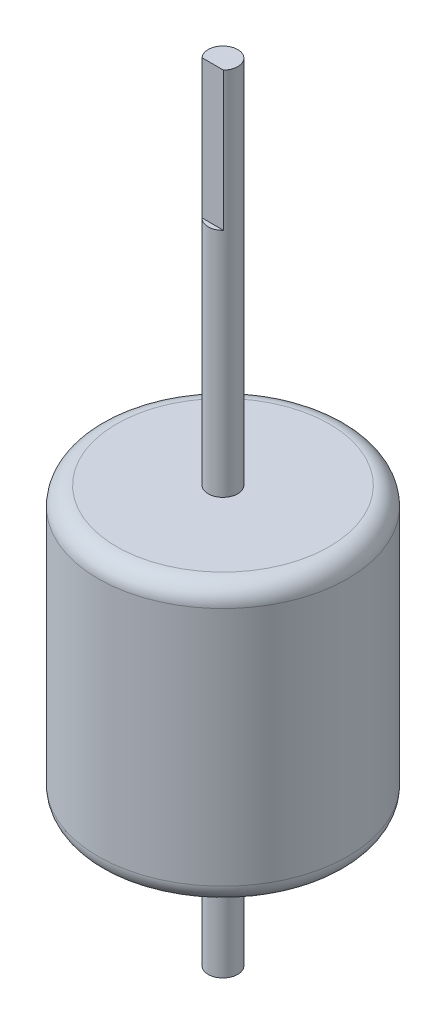
from build123d import *

# Parameters (mm, degrees)
ENL_V_MAT_EXTRU_1_DEPTH                   = 15
TROU_TARAUD_M31_D                         = 2.5
TROU_TARAUD_M31_DEPTH                     = 8.5
TROU_TARAUD_M31_TIP                       = 0.751075774
ESQUISSE5_W                               = 0.7
ESQUISSE5_H                               = 3.8
BOSS_EXTRU_1_DEPTH                        = 6.7
CHANFREIN1_SIZE                           = 1
ESQUISSE6_R                               = 0.8
ENL_V_MAT_EXTRU_2_DEPTH                   = 6.7
R_P_TITION_CIRCULAIRE1_COUNT              = 2
CHANFREIN1_OF_R_P_TITION_CIRCULAIRE1_SIZE = 1
ENL_V_MAT_EXTRU_4_DEPTH                   = 90.145947749
ENL_V_MAT_EXTRU_4_DEPTH_BACK              = 90.145947749
ESQUISSE7_R                               = 19
ESQUISSE7_R_2                             = 1.6


with BuildPart() as part:
    # Esquisse1 → Révolution1 (revolve)
    with BuildSketch(Plane.XY, mode=Mode.PRIVATE) as r_volution1_sk:
        with BuildLine():
            Line((0, 0), (-1.6, 0))
            Line((-1.6, 0), (-1.6, 2.6))
            Line((-1.6, 2.6), (-5.075, 2.6))
            Line((-5.075, 2.6), (-5.075, 4.5))
            Line((-5.075, 4.5), (-19, 4.5))
            Line((-19, 4.5), (-19, 58))
            Line((-19, 58), (-17.85, 58))
            Line((-17.85, 58), (-17.85, 60))
            ThreePointArc((-17.85, 60), (-17.410660172, 61.060660172), (-16.35, 61.5))
            Line((-16.35, 61.5), (-6.5, 61.5))
            Line((-6.5, 61.5), (-6.5, 65.8))
            Line((-6.5, 65.8), (-1.6, 65.8))
            Line((-1.6, 65.8), (-1.6, 85))
            Line((-1.6, 85), (0, 85))
            Line((0, 85), (0, 0))
        make_face()
    revolve(r_volution1_sk.sketch.rotate(Axis((0, 0, 0), (0, 1, 0)), 270), axis=Axis((0, 0, 0), (0, 1, 0)))

    # Esquisse2 → Enlèv. mat.-Extru.1 (cut)
    with BuildSketch(Plane(origin=(0, 85, 0), x_dir=(1, 0, 0), z_dir=(0, 1, 0))):
        with BuildLine():
            Line((-1.161895004, -1.1), (1.161895004, -1.1))
            ThreePointArc((1.161895004, -1.1), (0, -1.6), (-1.161895004, -1.1))
        make_face()
    extrude(amount=-ENL_V_MAT_EXTRU_1_DEPTH, mode=Mode.SUBTRACT)

    # Trou taraudé M31
    with Locations(Plane(origin=(0, 61.5, 0), x_dir=(-1, 0, 0), z_dir=(0, 1, 0))):
        with Locations((12.5, 0), (-12.5, 0)):
            Hole(TROU_TARAUD_M31_D / 2, depth=TROU_TARAUD_M31_DEPTH)
            with Locations((0, 0, -(TROU_TARAUD_M31_DEPTH + TROU_TARAUD_M31_TIP / 2))):  # 118° drill point
                Cone(0, TROU_TARAUD_M31_D / 2, TROU_TARAUD_M31_TIP, mode=Mode.SUBTRACT)

    # Esquisse5 → Boss.-Extru.1 (add)
    with BuildSketch(Plane.XZ.offset(-4.5)):
        with Locations((-13.95, 0)):
            Rectangle(ESQUISSE5_W, ESQUISSE5_H)
    boss_extru_1 = extrude(amount=BOSS_EXTRU_1_DEPTH)

    # Chanfrein1
    chanfrein1_edges = [part.edges().sort_by_distance(p)[0] for p in [
        (-13.95, -2.2, -1.9),
        (-13.95, -2.2, 1.9),
    ]]
    chamfer(chanfrein1_edges, length=CHANFREIN1_SIZE)

    # Esquisse6 → Enlèv. mat.-Extru.2 (cut)
    with BuildSketch(Plane.ZY.offset(14.3)):
        Circle(ESQUISSE6_R)
    enl_v_mat_extru_2 = extrude(amount=-ENL_V_MAT_EXTRU_2_DEPTH, mode=Mode.SUBTRACT)

    # Répétition circulaire1: Boss.-Extru.1, Enlèv. mat.-Extru.2 ×2 about axis
    r_p_tition_circulaire1_axis = Axis((0, 0, 0), (0, 1, 0))
    add([boss_extru_1.rotate(r_p_tition_circulaire1_axis, i * 360 / R_P_TITION_CIRCULAIRE1_COUNT) for i in range(1, R_P_TITION_CIRCULAIRE1_COUNT)])
    add([enl_v_mat_extru_2.rotate(r_p_tition_circulaire1_axis, i * 360 / R_P_TITION_CIRCULAIRE1_COUNT) for i in range(1, R_P_TITION_CIRCULAIRE1_COUNT)], mode=Mode.SUBTRACT)

    # Chanfrein1 of Répétition circulaire1
    chanfrein1_of_r_p_tition_circulaire1_edges = [part.edges().sort_by_distance(p)[0] for p in [
        (13.95, -2.2, 1.9),
        (13.95, -2.2, -1.9),
    ]]
    chamfer(chanfrein1_of_r_p_tition_circulaire1_edges, length=CHANFREIN1_OF_R_P_TITION_CIRCULAIRE1_SIZE)

    # Esquisse7 → Enlèv. mat.-Extru.4 (cut, two sides: drawn at the far end of the back side and taken through both)
    with BuildSketch(Plane.XZ.offset(-ENL_V_MAT_EXTRU_4_DEPTH_BACK)):
        Circle(ESQUISSE7_R)
        with Locations(Location((0, 0, 0), (0, 0, 270))):
            Circle(ESQUISSE7_R_2, mode=Mode.SUBTRACT)
    extrude(amount=ENL_V_MAT_EXTRU_4_DEPTH + ENL_V_MAT_EXTRU_4_DEPTH_BACK, mode=Mode.SUBTRACT)

    # Esquisse9 → Révolution2 (revolve)
    with BuildSketch(Plane.XY, mode=Mode.PRIVATE) as r_volution2_sk:
        with BuildLine():
            Line((0, 15), (11.5, 15))
            ThreePointArc((11.5, 15), (12.914213562, 15.585786438), (13.5, 17))
            Line((13.5, 17), (13.5, 43))
            ThreePointArc((13.5, 43), (12.914213562, 44.414213562), (11.5, 45))
            Line((11.5, 45), (0, 45))
            Line((0, 45), (0, 44.5))
            Line((0, 44.5), (10, 44.5))
            Line((10, 44.5), (10, 15.5))
            Line((10, 15.5), (0, 15.5))
            Line((0, 15.5), (0, 15))
        make_face()
    revolve(r_volution2_sk.sketch.rotate(Axis((0, 0, 0), (0, 1, 0)), 90), axis=Axis((0, 0, 0), (0, 1, 0)))


solid = part.part
